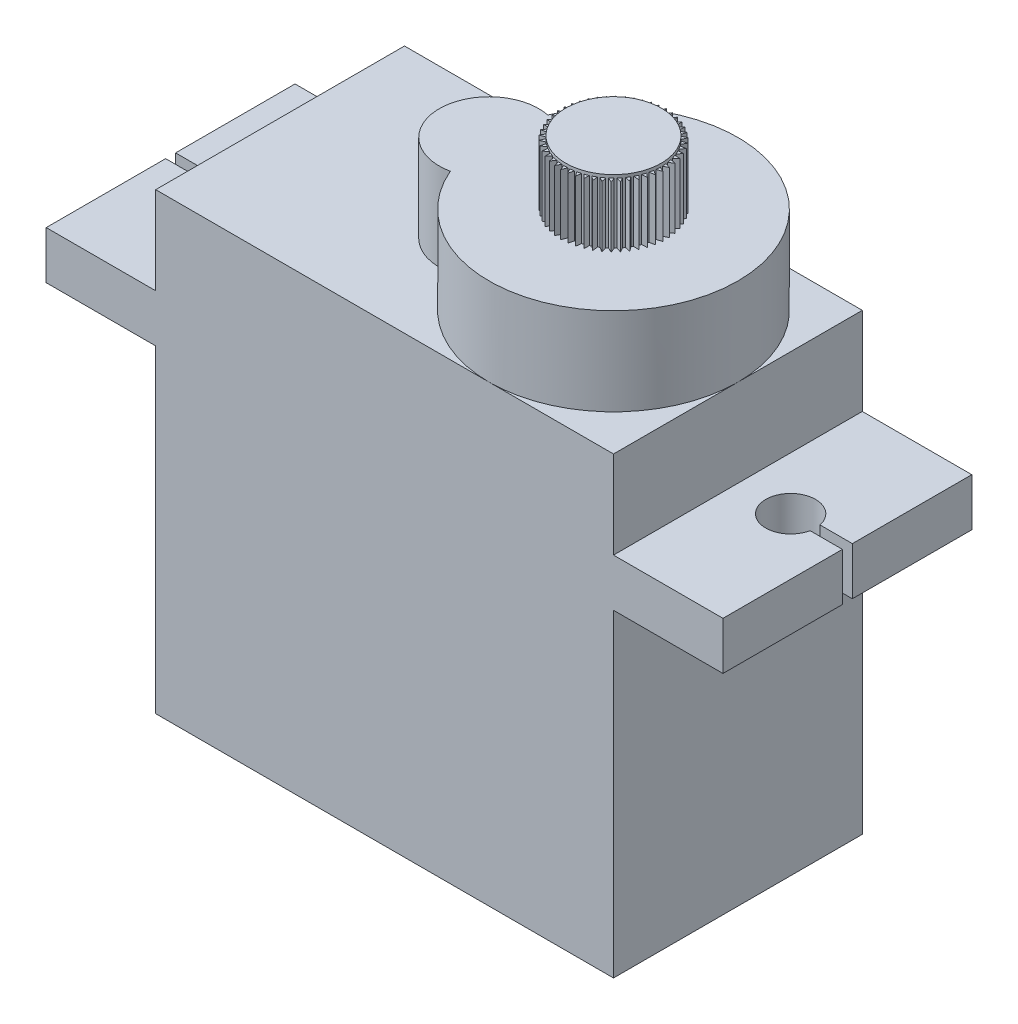
from build123d import *

# Parameters (mm, degrees)
SKETCH2_W           = 23
SKETCH2_H           = 12.5
BOSS_EXTRUDE1_DEPTH = 16
BOSS_EXTRUDE2_DEPTH = 2.4
SKETCH4_W           = 23
SKETCH4_H           = 12.5
BOSS_EXTRUDE3_DEPTH = 4.4
SKETCH5_R           = 1.25
CUT_EXTRUDE1_DEPTH  = 4.4
SKETCH6_W           = 3.848237884
SKETCH6_H           = 0.5
CUT_EXTRUDE2_DEPTH  = 4.4
SKETCH7_R           = 6.25
BOSS_EXTRUDE4_DEPTH = 4.4
SKETCH8_R           = 2.5
BOSS_EXTRUDE5_DEPTH = 4.4
SKETCH9_R           = 2.4
BOSS_EXTRUDE6_DEPTH = 3.2
BOSS_EXTRUDE7_DEPTH = 3.05
CIRPATTERN1_COUNT   = 50


with BuildPart() as part:
    # Sketch2 → Boss-Extrude1 (new body)
    with BuildSketch(Plane(origin=(0, 0, 0), x_dir=(1, 0, 0), z_dir=(0, 1, 0))):
        Rectangle(SKETCH2_W, SKETCH2_H)
    extrude(amount=BOSS_EXTRUDE1_DEPTH)

    # Sketch3 → Boss-Extrude2 (add)
    with BuildSketch(Plane(origin=(0, 16, 0), x_dir=(1, 0, 0), z_dir=(0, 1, 0))):
        Polygon((-11.5, 6.25), (-17, 6.25), (-17, -6.25), (-11.5, -6.25), (11.5, -6.25), (17, -6.25), (17, 6.25), (11.5, 6.25), align=None)
    extrude(amount=BOSS_EXTRUDE2_DEPTH)

    # Sketch4 → Boss-Extrude3 (add)
    with BuildSketch(Plane(origin=(0, 18.4, 0), x_dir=(1, 0, 0), z_dir=(0, 1, 0))):
        Rectangle(SKETCH4_W, SKETCH4_H)
    extrude(amount=BOSS_EXTRUDE3_DEPTH)

    # Sketch5 → Cut-Extrude1 (cut)
    with BuildSketch(Plane(origin=(0, 18.4, 0), x_dir=(1, 0, 0), z_dir=(0, 1, 0))):
        with Locations(Location((-14.15, 0, 0), (0, 0, 270))):
            Circle(SKETCH5_R)
    cut_extrude1 = extrude(amount=-CUT_EXTRUDE1_DEPTH, mode=Mode.SUBTRACT)

    # Mirror1: Cut-Extrude1 across plane
    add(cut_extrude1.mirror(Plane(origin=(0, 0, 0), x_dir=(0, 0, 1), z_dir=(1, 0, 0))), mode=Mode.SUBTRACT)

    # Sketch6 → Cut-Extrude2 (cut)
    with BuildSketch(Plane(origin=(0, 18.4, 0), x_dir=(1, 0, 0), z_dir=(0, 1, 0))):
        with Locations((-15.4, 0)):
            Rectangle(SKETCH6_W, SKETCH6_H)
    cut_extrude2 = extrude(amount=-CUT_EXTRUDE2_DEPTH, mode=Mode.SUBTRACT)

    # Mirror2: Cut-Extrude2 across plane
    add(cut_extrude2.mirror(Plane(origin=(0, 0, 0), x_dir=(0, 0, 1), z_dir=(1, 0, 0))), mode=Mode.SUBTRACT)

    # Sketch7 → Boss-Extrude4 (add)
    with BuildSketch(Plane(origin=(0, 22.8, 0), x_dir=(1, 0, 0), z_dir=(0, 1, 0))):
        with Locations(Location((5.25, 0, 0), (0, 0, 270))):
            Circle(SKETCH7_R)
    extrude(amount=BOSS_EXTRUDE4_DEPTH)

    # Sketch8 → Boss-Extrude5 (add)
    with BuildSketch(Plane(origin=(0, 22.8, 0), x_dir=(1, 0, 0), z_dir=(0, 1, 0))):
        with Locations((-1, 0)):
            Circle(SKETCH8_R)
    extrude(amount=BOSS_EXTRUDE5_DEPTH)

    # Sketch9 → Boss-Extrude6 (add)
    with BuildSketch(Plane(origin=(0, 27.2, 0), x_dir=(1, 0, 0), z_dir=(0, 1, 0))):
        with Locations(Location((5.25, 0, 0), (0, 0, 270))):
            Circle(SKETCH9_R)
    extrude(amount=BOSS_EXTRUDE6_DEPTH)

    # Sketch10 → Boss-Extrude7 (add)
    with BuildSketch(Plane(origin=(0, 27.2, 0), x_dir=(1, 0, 0), z_dir=(0, 1, 0))):
        Polygon((5.35, 2.397915762), (5.25, 2.651588341), (5.15, 2.397915762), (5.25, 2.297915762), align=None)
    boss_extrude7 = extrude(amount=BOSS_EXTRUDE7_DEPTH)

    # CirPattern1: Boss-Extrude7 ×50 about axis
    cirpattern1_axis = Axis((5.25, 0, 0), (0, 1, 0))
    for i in range(1, CIRPATTERN1_COUNT):
        add(boss_extrude7.rotate(cirpattern1_axis, i * 360 / CIRPATTERN1_COUNT))


solid = part.part
